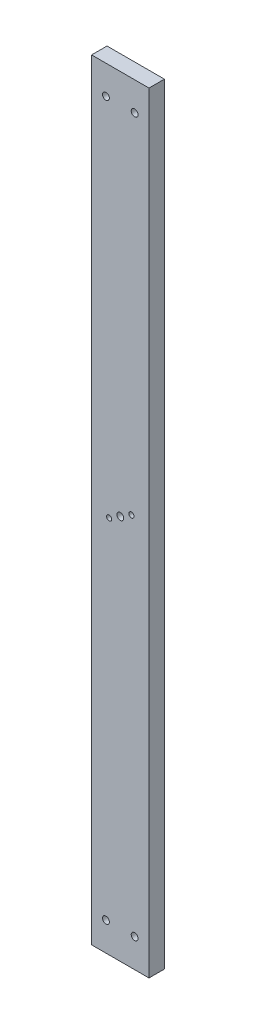
from build123d import *

# Parameters (mm, degrees)
WOODBASE_W          = 67
WOODBASE_H          = 900
WOODBASE_R          = 4
WOODBASE_R_2        = 3
BOSS_EXTRUDE1_DEPTH = 18


with BuildPart() as part:
    # woodbase → Boss-Extrude1 (new body)
    with BuildSketch(Plane.XY):
        with Locations((325.338433817, -11.052631579)):
            Rectangle(WOODBASE_W, WOODBASE_H)
        with Locations((325.338433817, -11.052631579)):
            Circle(WOODBASE_R, mode=Mode.SUBTRACT)
        with Locations((312.338433817, -19.052631579)):
            Circle(WOODBASE_R_2, mode=Mode.SUBTRACT)
        with Locations((338.338433817, -3.052631579)):
            Circle(WOODBASE_R_2, mode=Mode.SUBTRACT)
        with Locations((308.588433817, -427.552631579)):
            Circle(WOODBASE_R, mode=Mode.SUBTRACT)
        with Locations((342.088433817, -427.552631579)):
            Circle(WOODBASE_R, mode=Mode.SUBTRACT)
        with Locations(Location((342.088433817, 405.447368421, 0), (0, 0, 180))):
            Circle(WOODBASE_R, mode=Mode.SUBTRACT)
        with Locations(Location((308.588433817, 405.447368421, 0), (0, 0, 180))):
            Circle(WOODBASE_R, mode=Mode.SUBTRACT)
    extrude(amount=BOSS_EXTRUDE1_DEPTH)


solid = part.part
